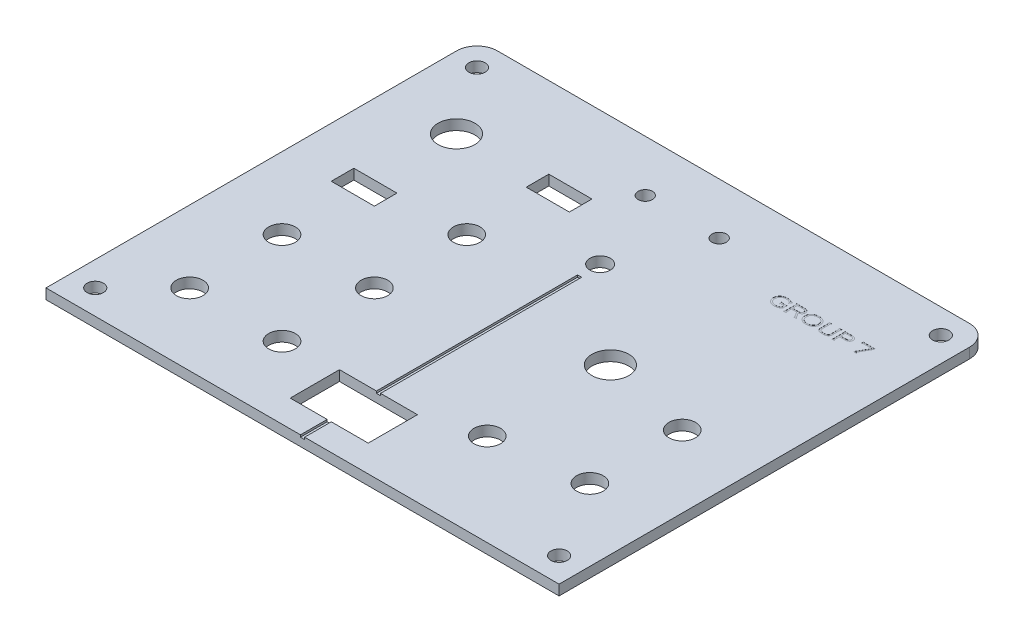
from build123d import *

# Parameters (mm, degrees)
SKETCH1_W               = 125
SKETCH1_H               = 105
BOSS_EXTRUDE1_DEPTH     = 2.5
SKETCH2_R               = 4.5
CUT_EXTRUDE2_DEPTH      = 10
SKETCH3_R               = 3.25
CUT_EXTRUDE3_DEPTH      = 10
SKETCH4_W               = 10.5
SKETCH4_H               = 5.5
CUT_EXTRUDE4_DEPTH      = 20
SKETCH5_R               = 3.25
CUT_EXTRUDE5_DEPTH      = 10
SKETCH6_R               = 4.5
CUT_EXTRUDE6_DEPTH      = 10
SKETCH7_R               = 3.25
CUT_EXTRUDE7_DEPTH      = 10
SKETCH8_W               = 10.5
SKETCH8_H               = 5.5
CUT_EXTRUDE8_DEPTH      = 10
SKETCH9_R               = 3.25
CUT_EXTRUDE9_DEPTH      = 10
SKETCH15_W              = 1
SKETCH15_H              = 70
CUT_EXTRUDE11_DEPTH     = 0.5
SKETCH19_R              = 2
CUT_EXTRUDE13_DEPTH     = 10
MIRROR3_COPY_1_SKETCH_R = 2
MIRROR3_COPY_1_DEPTH    = 10
MIRROR3_COPY_2_SKETCH_R = 2
MIRROR3_COPY_2_DEPTH    = 10
SKETCH20_R              = 2.5
CUT_EXTRUDE14_DEPTH     = 10
SKETCH21_R              = 1.75
CUT_EXTRUDE15_DEPTH     = 10
FILLET1_R               = 5
FILLET2_R               = 5
SKETCH26_W              = 19
SKETCH26_H              = 12
CUT_EXTRUDE16_DEPTH     = 10
SKETCH27_R              = 3.25
CUT_EXTRUDE17_DEPTH     = 10
CUT_EXTRUDE18_DEPTH     = 0.0254


with BuildPart() as part:
    # Sketch1 → Boss-Extrude1 (new body)
    with BuildSketch(Plane(origin=(0, 0, 0), x_dir=(1, 0, 0), z_dir=(0, 1, 0))):
        Rectangle(SKETCH1_W, SKETCH1_H)
    extrude(amount=BOSS_EXTRUDE1_DEPTH)

    # Sketch2 → Cut-Extrude2 (cut)
    with BuildSketch(Plane(origin=(0, 2.5, 0), x_dir=(1, 0, 0), z_dir=(0, 1, 0))):
        with Locations(Location((-45, 30, 0), (0, 0, 270))):
            Circle(SKETCH2_R)
    extrude(amount=-CUT_EXTRUDE2_DEPTH, mode=Mode.SUBTRACT)

    # Sketch3 → Cut-Extrude3 (cut)
    with BuildSketch(Plane(origin=(0, 2.5, 0), x_dir=(1, 0, 0), z_dir=(0, 1, 0))):
        with Locations(Location((-45, -35, 0), (0, 0, 270))):
            Circle(SKETCH3_R)
    extrude(amount=-CUT_EXTRUDE3_DEPTH, mode=Mode.SUBTRACT)

    # Sketch4 → Cut-Extrude4 (cut)
    with BuildSketch(Plane(origin=(0, 2.5, 0), x_dir=(1, 0, 0), z_dir=(0, 1, 0))):
        with Locations((-20, 30)):
            Rectangle(SKETCH4_W, SKETCH4_H)
    extrude(amount=-CUT_EXTRUDE4_DEPTH, mode=Mode.SUBTRACT)

    # Sketch5 → Cut-Extrude5 (cut)
    with BuildSketch(Plane(origin=(0, 2.5, 0), x_dir=(1, 0, 0), z_dir=(0, 1, 0))):
        with Locations(Location((-22.5, 10, 0), (0, 0, 270))):
            Circle(SKETCH5_R)
        with Locations(Location((-22.5, -12.5, 0), (0, 0, 270))):
            Circle(SKETCH5_R)
        with Locations(Location((-22.5, -35, 0), (0, 0, 270))):
            Circle(SKETCH5_R)
    extrude(amount=-CUT_EXTRUDE5_DEPTH, mode=Mode.SUBTRACT)

    # Sketch6 → Cut-Extrude6 (cut)
    with BuildSketch(Plane(origin=(0, 2.5, 0), x_dir=(1, 0, 0), z_dir=(0, 1, 0))):
        with Locations(Location((22.5, 0, 0), (0, 0, 270))):
            Circle(SKETCH6_R)
    extrude(amount=-CUT_EXTRUDE6_DEPTH, mode=Mode.SUBTRACT)

    # Sketch7 → Cut-Extrude7 (cut)
    with BuildSketch(Plane(origin=(0, 2.5, 0), x_dir=(1, 0, 0), z_dir=(0, 1, 0))):
        with Locations(Location((22.5, -30, 0), (0, 0, 270))):
            Circle(SKETCH7_R)
    extrude(amount=-CUT_EXTRUDE7_DEPTH, mode=Mode.SUBTRACT)

    # Sketch8 → Cut-Extrude8 (cut)
    with BuildSketch(Plane(origin=(0, 2.5, 0), x_dir=(1, 0, 0), z_dir=(0, 1, 0))):
        with Locations((-45, 7.5)):
            Rectangle(SKETCH8_W, SKETCH8_H)
    extrude(amount=-CUT_EXTRUDE8_DEPTH, mode=Mode.SUBTRACT)

    # Sketch9 → Cut-Extrude9 (cut)
    with BuildSketch(Plane(origin=(0, 2.5, 0), x_dir=(1, 0, 0), z_dir=(0, 1, 0))):
        with Locations(Location((45, -5, 0), (0, 0, 270))):
            Circle(SKETCH9_R)
        with Locations(Location((45, -27.5, 0), (0, 0, 270))):
            Circle(SKETCH9_R)
    extrude(amount=-CUT_EXTRUDE9_DEPTH, mode=Mode.SUBTRACT)

    # Sketch15 → Cut-Extrude11 (cut)
    with BuildSketch(Plane(origin=(0, 2.5, 0), x_dir=(1, 0, 0), z_dir=(0, 1, 0))):
        with Locations((0, -20)):
            Rectangle(SKETCH15_W, SKETCH15_H)
    extrude(amount=-CUT_EXTRUDE11_DEPTH, mode=Mode.SUBTRACT)

    # Sketch19 → Cut-Extrude13 (cut)
    with BuildSketch(Plane(origin=(0, 2.5, 0), x_dir=(1, 0, 0), z_dir=(0, 1, 0))):
        with Locations(Location((-56.5, 46.5, 0), (0, 0, 270))):
            Circle(SKETCH19_R)
    cut_extrude13 = extrude(amount=-CUT_EXTRUDE13_DEPTH, mode=Mode.SUBTRACT)

    # Mirror1: Cut-Extrude13 across plane
    add(cut_extrude13.mirror(Plane.XY), mode=Mode.SUBTRACT)

    # Mirror2: Cut-Extrude13 across plane
    add(cut_extrude13.mirror(Plane(origin=(0, 0, 0), x_dir=(0, 0, 1), z_dir=(1, 0, 0))), mode=Mode.SUBTRACT)

    # Mirror3 copy 1 sketch → Mirror3 copy 1 (cut)
    with BuildSketch(Plane(origin=(0, 2.5, 0), x_dir=(-1, 0, 0), z_dir=(0, 1, 0))):
        with Locations(Location((-56.5, 46.5, 0), (0, 0, 270))):
            Circle(MIRROR3_COPY_1_SKETCH_R)
    extrude(amount=-MIRROR3_COPY_1_DEPTH, mode=Mode.SUBTRACT)

    # Mirror3 copy 2 sketch → Mirror3 copy 2 (cut)
    with BuildSketch(Plane(origin=(0, 2.5, 0), x_dir=(1, 0, 0), z_dir=(0, 1, 0))):
        with Locations((-56.5, -46.5)):
            Circle(MIRROR3_COPY_2_SKETCH_R)
    extrude(amount=-MIRROR3_COPY_2_DEPTH, mode=Mode.SUBTRACT)

    # Sketch20 → Cut-Extrude14 (cut)
    with BuildSketch(Plane(origin=(0, 2.5, 0), x_dir=(1, 0, 0), z_dir=(0, 1, 0))):
        with Locations(Location((0, 20, 0), (0, 0, 270))):
            Circle(SKETCH20_R)
    extrude(amount=-CUT_EXTRUDE14_DEPTH, mode=Mode.SUBTRACT)

    # Sketch21 → Cut-Extrude15 (cut)
    with BuildSketch(Plane(origin=(0, 2.5, 0), x_dir=(1, 0, 0), z_dir=(0, 1, 0))):
        with Locations(Location((9, 40, 0), (0, 0, 270))):
            Circle(SKETCH21_R)
    cut_extrude15 = extrude(amount=-CUT_EXTRUDE15_DEPTH, mode=Mode.SUBTRACT)

    # Mirror4: Cut-Extrude15 across plane
    add(cut_extrude15.mirror(Plane(origin=(0, 0, 0), x_dir=(0, 0, 1), z_dir=(1, 0, 0))), mode=Mode.SUBTRACT)

    # Fillet1
    fillet1_edges = [part.edges().sort_by_distance(p)[0] for p in [
        (62.5, 1.25, -52.5),
    ]]
    fillet(fillet1_edges, radius=FILLET1_R)

    # Fillet2
    fillet2_edges = [part.edges().sort_by_distance(p)[0] for p in [
        (-62.5, 1.25, -52.5),
    ]]
    fillet(fillet2_edges, radius=FILLET2_R)

    # Sketch26 → Cut-Extrude16 (cut)
    with BuildSketch(Plane(origin=(0, 2.5, 0), x_dir=(1, 0, 0), z_dir=(0, 1, 0))):
        with Locations((0, -40)):
            Rectangle(SKETCH26_W, SKETCH26_H)
    extrude(amount=-CUT_EXTRUDE16_DEPTH, mode=Mode.SUBTRACT)

    # Sketch27 → Cut-Extrude17 (cut)
    with BuildSketch(Plane(origin=(0, 2.5, 0), x_dir=(1, 0, 0), z_dir=(0, 1, 0))):
        with Locations(Location((-45, -12.5, 0), (0, 0, 270))):
            Circle(SKETCH27_R)
    extrude(amount=-CUT_EXTRUDE17_DEPTH, mode=Mode.SUBTRACT)

    # Sketch28 → Cut-Extrude18 (cut)
    # profile 1 of 6: a face of its own
    with BuildSketch(Plane(origin=(0, 2.5, 0), x_dir=(1, 0, 0), z_dir=(0, 1, 0))):
        with BuildLine():
            Line((31.594782388, 35.297109122), (31.219955999, 34.730046405))
            Line((31.219955999, 34.730046405), (31.160011338, 34.77207657))
            add(Edge.make_bspline(
                [(31.160011338, 34.77207657), (31.166130945, 34.782793931), (31.177399026, 34.802527892), (31.190781805, 34.830659801), (31.198988564, 34.854782467), (31.200635517, 34.86964734), (31.201352483, 34.876118454)],
                knots=[0, 0, 0, 0, 1.311070168, 2.41408384, 3.309604391, 4, 4, 4, 4], degree=3))
            add(Edge.make_bspline(
                [(31.201352483, 34.876118454), (31.200333577, 34.882663261), (31.198104889, 34.896978925), (31.185619937, 34.918420066), (31.165726489, 34.940798246), (31.13868146, 34.965813022), (31.103130154, 34.991275361), (31.060883564, 35.01996203), (31.010528596, 35.04993), (30.974037205, 35.070073714), (30.954683647, 35.080757126)],
                knots=[0, 0, 0, 0, 0.479681411, 1.049222262, 1.774183608, 2.663260629, 3.728642312, 4.959827133, 6.387615278, 8, 8, 8, 8], degree=3))
            add(Edge.make_bspline(
                [(30.954683647, 35.080757126), (30.915222774, 35.101754293), (30.837249692, 35.143243843), (30.716668915, 35.195201455), (30.596153125, 35.240002881), (30.474990034, 35.278043441), (30.352552577, 35.30589116), (30.229412563, 35.325771899), (30.105864155, 35.338866024), (30.023162275, 35.340425953), (29.981788681, 35.341206344)],
                knots=[0, 0, 0, 0, 1.053577382, 2.081826103, 3.092788234, 4.084582288, 5.073770794, 6.050427979, 7.024679971, 8, 8, 8, 8], degree=3))
            add(Edge.make_bspline(
                [(29.981788681, 35.341206344), (29.934423314, 35.34045827), (29.841480579, 35.338990362), (29.704956856, 35.322137651), (29.57391722, 35.297303577), (29.448480239, 35.261238292), (29.329077662, 35.215009369), (29.215038342, 35.158770186), (29.10664523, 35.092279306), (29.039667471, 35.040062569), (29.00613764, 35.013922273)],
                knots=[0, 0, 0, 0, 1.081755317, 2.122675345, 3.138566733, 4.12691774, 5.100570372, 6.060533882, 7.029081099, 8, 8, 8, 8], degree=3))
            add(Edge.make_bspline(
                [(29.00613764, 35.013922273), (28.970011743, 34.982315643), (28.898826824, 34.920035793), (28.806170418, 34.814073181), (28.726661254, 34.700868294), (28.663138266, 34.578247795), (28.613247821, 34.447871609), (28.577573642, 34.309461509), (28.555631276, 34.162997444), (28.553277695, 34.062694978), (28.552074055, 34.011399487)],
                knots=[0, 0, 0, 0, 1.009781546, 1.98974211, 2.955664053, 3.916098172, 4.889689536, 5.889075866, 6.920456337, 8, 8, 8, 8], degree=3))
            add(Edge.make_bspline(
                [(28.552074055, 34.011399487), (28.553299611, 33.961248141), (28.555694247, 33.863256475), (28.577271647, 33.720451197), (28.610189814, 33.585135564), (28.659301214, 33.458333723), (28.720593036, 33.338528295), (28.797161691, 33.227557918), (28.886346933, 33.123444068), (28.955297558, 33.062528937), (28.9902902, 33.031614331)],
                knots=[0, 0, 0, 0, 1.082875897, 2.115851736, 3.113542928, 4.085773228, 5.04674435, 6.01430349, 6.99225325, 8, 8, 8, 8], degree=3))
            add(Edge.make_bspline(
                [(28.9902902, 33.031614331), (29.02446509, 33.00472398), (29.092779049, 32.950971462), (29.204798803, 32.882789617), (29.323644404, 32.824825608), (29.449304011, 32.777167793), (29.58198624, 32.740605794), (29.721666732, 32.714671039), (29.868413219, 32.698553967), (29.968655533, 32.696446059), (30.019684732, 32.695373011)],
                knots=[0, 0, 0, 0, 0.943408857, 1.885828905, 2.840281506, 3.810814444, 4.799180104, 5.824075897, 6.892327404, 8, 8, 8, 8], degree=3))
            add(Edge.make_bspline(
                [(30.019684732, 32.695373011), (30.074172649, 32.69650655), (30.182347313, 32.698756961), (30.342354488, 32.718532528), (30.498271698, 32.751183301), (30.649093012, 32.795561764), (30.792486327, 32.851434263), (30.925044757, 32.918441143), (31.046661489, 32.994532651), (31.118391993, 33.054874147), (31.153810166, 33.084668801)],
                knots=[0, 0, 0, 0, 1.067475704, 2.119255615, 3.153810372, 4.186316862, 5.196810412, 6.165000349, 7.093937309, 8, 8, 8, 8], degree=3))
            Line((31.153810166, 33.084668801), (31.153810166, 33.6655119))
            Line((31.153810166, 33.6655119), (30.422760904, 33.6655119))
            add(Edge.make_bspline(
                [(30.422760904, 33.6655119), (30.408033476, 33.665447177), (30.380750286, 33.665327275), (30.343381466, 33.659536224), (30.312486127, 33.651884758), (30.287409096, 33.639907792), (30.267420751, 33.622011454), (30.251947781, 33.597695766), (30.238097114, 33.567777713), (30.23137128, 33.545274419), (30.227768499, 33.533220233)],
                knots=[0, 0, 0, 0, 1.342563101, 2.487155639, 3.44341224, 4.240445972, 4.99788562, 5.858567641, 6.852913584, 8, 8, 8, 8], degree=3))
            Line((30.227768499, 33.533220233), (30.139574055, 33.533220233))
            Line((30.139574055, 33.533220233), (30.139574055, 34.106484122))
            Line((30.139574055, 34.106484122), (30.227768499, 34.106484122))
            add(Edge.make_bspline(
                [(30.227768499, 34.106484122), (30.23137128, 34.094429937), (30.238097114, 34.071926642), (30.251947781, 34.042008589), (30.267420751, 34.017692902), (30.287409096, 33.999796563), (30.312486127, 33.987819597), (30.343381466, 33.980168131), (30.380750286, 33.974377081), (30.408033476, 33.974257179), (30.422760904, 33.974192456)],
                knots=[0, 0, 0, 0, 1.147086416, 2.141432359, 3.00211438, 3.759554028, 4.55658776, 5.512844361, 6.657436899, 8, 8, 8, 8], degree=3))
            Line((30.422760904, 33.974192456), (31.63887961, 33.974192456))
            Line((31.63887961, 33.974192456), (31.63887961, 33.885998011))
            add(Edge.make_bspline(
                [(31.63887961, 33.885998011), (31.626869265, 33.882307271), (31.604538478, 33.875445094), (31.574176409, 33.862703005), (31.550593635, 33.84697059), (31.532399971, 33.828715376), (31.520142997, 33.805519601), (31.512543175, 33.776611416), (31.50675803, 33.741298274), (31.50664771, 33.715381547), (31.506587944, 33.701340893)],
                knots=[0, 0, 0, 0, 1.188810764, 2.21035107, 3.102339709, 3.855401953, 4.62367284, 5.551978086, 6.67375882, 8, 8, 8, 8], degree=3))
            Line((31.506587944, 33.701340893), (31.506587944, 33.321002351))
            add(Edge.make_bspline(
                [(31.506587944, 33.321002351), (31.50661705, 33.306955162), (31.506670304, 33.281253696), (31.51275539, 33.246017588), (31.519982618, 33.216993077), (31.53244028, 33.193678001), (31.550383931, 33.175276387), (31.574587996, 33.16060445), (31.60430058, 33.146631973), (31.626817907, 33.139933408), (31.63887961, 33.136345233)],
                knots=[0, 0, 0, 0, 1.326839066, 2.427653517, 3.377261368, 4.145878602, 4.899280336, 5.779674258, 6.810653305, 8, 8, 8, 8], degree=3))
            Line((31.63887961, 33.136345233), (31.63887961, 33.048150789))
            add(Edge.make_bspline(
                [(31.63887961, 33.048150789), (31.596074441, 33.010042594), (31.513208855, 32.93626978), (31.387083282, 32.836593533), (31.265188124, 32.749292625), (31.182623783, 32.69990863), (31.14278586, 32.676080476)],
                knots=[0, 0, 0, 0, 1.106719285, 2.142473504, 3.103729327, 4, 4, 4, 4], degree=3))
            add(Edge.make_bspline(
                [(31.14278586, 32.676080476), (31.100119022, 32.653014832), (31.0147509, 32.60686492), (30.881530813, 32.54764766), (30.743773126, 32.497928287), (30.601499491, 32.457219058), (30.454617206, 32.425675965), (30.303467833, 32.402789486), (30.147842972, 32.389751323), (30.042675591, 32.387721394), (29.989367891, 32.386692456)],
                knots=[0, 0, 0, 0, 0.967559955, 1.935901058, 2.905759258, 3.887798191, 4.886463983, 5.901453271, 6.93627949, 8, 8, 8, 8], degree=3))
            add(Edge.make_bspline(
                [(29.989367891, 32.386692456), (29.924546131, 32.388008607), (29.797571628, 32.390586718), (29.612127204, 32.4109367), (29.435909264, 32.443586933), (29.269485904, 32.490616526), (29.112042122, 32.550308256), (28.9647697, 32.624883434), (28.825807935, 32.710902539), (28.741999399, 32.779621563), (28.700213161, 32.813884296)],
                knots=[0, 0, 0, 0, 1.120561648, 2.19498449, 3.221503495, 4.215912035, 5.181296155, 6.127874861, 7.066573986, 8, 8, 8, 8], degree=3))
            add(Edge.make_bspline(
                [(28.700213161, 32.813884296), (28.66131726, 32.849874912), (28.583646383, 32.921744253), (28.480834421, 33.043281848), (28.390586769, 33.175355623), (28.340797656, 33.269950767), (28.315740504, 33.317557256)],
                knots=[0, 0, 0, 0, 0.996438765, 1.989779697, 2.98832511, 4, 4, 4, 4], degree=3))
            add(Edge.make_bspline(
                [(28.315740504, 33.317557256), (28.302733198, 33.345416613), (28.276836782, 33.400882169), (28.24476816, 33.486728232), (28.217235887, 33.57343859), (28.194143743, 33.661189546), (28.177118579, 33.750326377), (28.164771052, 33.840483446), (28.156905371, 33.931794579), (28.155770102, 33.993010083), (28.155199055, 34.023801831)],
                knots=[0, 0, 0, 0, 1.010000702, 2.010823509, 3.008539713, 3.998863838, 4.990567406, 5.988540485, 6.988224375, 8, 8, 8, 8], degree=3))
            add(Edge.make_bspline(
                [(28.155199055, 34.023801831), (28.156122175, 34.067707172), (28.157949354, 34.154611278), (28.172613734, 34.283023536), (28.197428059, 34.407448084), (28.232283001, 34.527789506), (28.275518837, 34.644913648), (28.329468496, 34.758125269), (28.393758221, 34.867369972), (28.443137455, 34.936418049), (28.468013725, 34.971203089)],
                knots=[0, 0, 0, 0, 1.037084025, 2.052753884, 3.048797332, 4.031149219, 5.009807646, 5.995211902, 6.990027867, 8, 8, 8, 8], degree=3))
            add(Edge.make_bspline(
                [(28.468013725, 34.971203089), (28.492816029, 35.002372965), (28.542106725, 35.06431821), (28.624217742, 35.15020635), (28.712330014, 35.229280002), (28.806657833, 35.302201887), (28.907457895, 35.368305212), (29.014455052, 35.427986546), (29.12704751, 35.482671507), (29.205921641, 35.512245459), (29.245916286, 35.527241501)],
                knots=[0, 0, 0, 0, 0.985391011, 1.958310304, 2.936346382, 3.912927983, 4.906091213, 5.916379487, 6.943460142, 8, 8, 8, 8], degree=3))
            add(Edge.make_bspline(
                [(29.245916286, 35.527241501), (29.304177778, 35.5462643), (29.421616134, 35.584608773), (29.604756854, 35.622149207), (29.793980812, 35.645723267), (29.922230803, 35.648485453), (29.987300834, 35.6498869)],
                knots=[0, 0, 0, 0, 0.973473779, 1.962242214, 2.966105487, 4, 4, 4, 4], degree=3))
            add(Edge.make_bspline(
                [(29.987300834, 35.6498869), (30.044071348, 35.649111777), (30.156005284, 35.647583474), (30.320297404, 35.631016762), (30.478524264, 35.605877346), (30.63234448, 35.569434928), (30.786161663, 35.521106941), (30.943238583, 35.45908394), (31.106197515, 35.384755522), (31.214519563, 35.326885119), (31.270254393, 35.297109122)],
                knots=[0, 0, 0, 0, 1.011571596, 1.994507037, 2.940101153, 3.865550783, 4.809441924, 5.811416899, 6.873910635, 8, 8, 8, 8], degree=3))
            add(Edge.make_bspline(
                [(31.270254393, 35.297109122), (31.285413635, 35.289057726), (31.312188959, 35.274836782), (31.34724412, 35.256370266), (31.373012563, 35.245048134), (31.387576223, 35.242302287), (31.392899792, 35.241298575)],
                knots=[0, 0, 0, 0, 1.521960149, 2.68819359, 3.52048505, 4, 4, 4, 4], degree=3))
            add(Edge.make_bspline(
                [(31.392899792, 35.241298575), (31.40022175, 35.242917324), (31.417801171, 35.246803808), (31.443323344, 35.26789477), (31.474051279, 35.297967275), (31.494905849, 35.323473461), (31.506587944, 35.337761249)],
                knots=[0, 0, 0, 0, 0.585328424, 1.405325703, 2.546542555, 4, 4, 4, 4], degree=3))
            Line((31.506587944, 35.337761249), (31.594782388, 35.297109122))
        make_face()
    # profile 2 of 6: a face of its own
    with BuildSketch(Plane(origin=(0, 2.5, 0), x_dir=(1, 0, 0), z_dir=(0, 1, 0))):
        with BuildLine():
            Line((32.741310166, 33.841900789), (32.741310166, 32.713976527))
            add(Edge.make_bspline(
                [(32.741310166, 32.713976527), (32.741377796, 32.699480081), (32.741502936, 32.672656274), (32.747239626, 32.635949306), (32.755078201, 32.605587775), (32.766881916, 32.580657371), (32.784991141, 32.56072607), (32.809028136, 32.54449136), (32.839000258, 32.529981083), (32.861544025, 32.522816296), (32.873601832, 32.518984122)],
                knots=[0, 0, 0, 0, 1.327292751, 2.455984248, 3.396056187, 4.196519374, 4.957218112, 5.833575765, 6.841261664, 8, 8, 8, 8], degree=3))
            Line((32.873601832, 32.518984122), (32.873601832, 32.430789678))
            Line((32.873601832, 32.430789678), (32.256240721, 32.430789678))
            Line((32.256240721, 32.430789678), (32.256240721, 32.518984122))
            add(Edge.make_bspline(
                [(32.256240721, 32.518984122), (32.268298611, 32.52281627), (32.290842532, 32.52998101), (32.320813657, 32.544491593), (32.344853728, 32.56072536), (32.362953059, 32.580659697), (32.374892792, 32.605780085), (32.382637052, 32.6368783), (32.388325947, 32.674730546), (32.388460071, 32.702466716), (32.388532388, 32.717421622)],
                knots=[0, 0, 0, 0, 1.143860438, 2.138607913, 3.003713363, 3.754644928, 4.544830376, 5.492870617, 6.648195317, 8, 8, 8, 8], degree=3))
            Line((32.388532388, 32.717421622), (32.388532388, 35.319157733))
            add(Edge.make_bspline(
                [(32.388532388, 35.319157733), (32.388471777, 35.334116777), (32.388359365, 35.361860619), (32.382500072, 35.3998842), (32.375074358, 35.431334011), (32.36273294, 35.456652082), (32.345116394, 35.477216875), (32.320925725, 35.493517268), (32.290770012, 35.507218021), (32.268285074, 35.513975501), (32.256240721, 35.517595233)],
                knots=[0, 0, 0, 0, 1.348407392, 2.500828586, 3.466505965, 4.254705557, 5.01937148, 5.882302788, 6.865627628, 8, 8, 8, 8], degree=3))
            Line((32.256240721, 35.517595233), (32.256240721, 35.605789678))
            Line((32.256240721, 35.605789678), (34.001526095, 35.605789678))
            add(Edge.make_bspline(
                [(34.001526095, 35.605789678), (34.058030257, 35.605170756), (34.165112088, 35.603997829), (34.316412242, 35.59777411), (34.44910033, 35.585520404), (34.565237004, 35.568652482), (34.668510161, 35.544979191), (34.763080396, 35.514500872), (34.850918661, 35.477250601), (34.904673201, 35.445599035), (34.931012857, 35.430089808)],
                knots=[0, 0, 0, 0, 1.414819568, 2.681244393, 3.790189265, 4.749857557, 5.617503166, 6.439488343, 7.235351294, 8, 8, 8, 8], degree=3))
            add(Edge.make_bspline(
                [(34.931012857, 35.430089808), (34.956827446, 35.412643095), (35.008263782, 35.37788), (35.076055314, 35.312820689), (35.137525131, 35.240065424), (35.170591476, 35.185072725), (35.187327961, 35.157238245)],
                knots=[0, 0, 0, 0, 0.987068848, 1.966764049, 2.970880412, 4, 4, 4, 4], degree=3))
            add(Edge.make_bspline(
                [(35.187327961, 35.157238245), (35.204589578, 35.123660038), (35.239110248, 35.056508607), (35.274026657, 34.947341433), (35.295175681, 34.832164867), (35.297675285, 34.753107603), (35.298949055, 34.712820928)],
                knots=[0, 0, 0, 0, 0.976717653, 1.953290301, 2.95702022, 4, 4, 4, 4], degree=3))
            add(Edge.make_bspline(
                [(35.298949055, 34.712820928), (35.298452673, 34.682686372), (35.297478633, 34.623553881), (35.284938509, 34.537179), (35.266980315, 34.45454069), (35.239760292, 34.37666138), (35.205659744, 34.302805467), (35.164557797, 34.232772577), (35.114197801, 34.168104961), (35.057928512, 34.107168779), (34.994400281, 34.052272585), (34.925196995, 34.003102415), (34.850386707, 33.960297256), (34.769924871, 33.923551147), (34.683590086, 33.893475879), (34.591730902, 33.869208215), (34.494158376, 33.85221557), (34.427160948, 33.845391558), (34.392888942, 33.841900789)],
                knots=[0, 0, 0, 0, 1.032453981, 2.025965659, 2.986981725, 3.928436394, 4.848129052, 5.773335344, 6.705853521, 7.653153547, 8.613330213, 9.579206836, 10.559963337, 11.56437173, 12.608029044, 13.691145095, 14.818923504, 16, 16, 16, 16], degree=3))
            Line((34.392888942, 33.841900789), (35.182504827, 32.632672273))
            add(Edge.make_bspline(
                [(35.182504827, 32.632672273), (35.194774465, 32.615392962), (35.218481664, 32.582006152), (35.267305614, 32.544818572), (35.324671622, 32.522273835), (35.36580097, 32.520108), (35.387143499, 32.518984122)],
                knots=[0, 0, 0, 0, 1.032470711, 1.994923467, 2.959540884, 4, 4, 4, 4], degree=3))
            Line((35.387143499, 32.518984122), (35.387143499, 32.430789678))
            Line((35.387143499, 32.430789678), (34.706392631, 32.430789678))
            Line((34.706392631, 32.430789678), (34.706392631, 32.518984122))
            add(Edge.make_bspline(
                [(34.706392631, 32.518984122), (34.72214855, 32.522248526), (34.749841337, 32.527986079), (34.784632323, 32.540553213), (34.808642906, 32.558856801), (34.812259175, 32.575096802), (34.81387961, 32.582373879)],
                knots=[0, 0, 0, 0, 1.445170674, 2.540048811, 3.345801974, 4, 4, 4, 4], degree=3))
            add(Edge.make_bspline(
                [(34.81387961, 32.582373879), (34.812441002, 32.588404364), (34.808420073, 32.605259642), (34.792841174, 32.635451072), (34.769774131, 32.678757992), (34.750006163, 32.711324077), (34.738776529, 32.729823966)],
                knots=[0, 0, 0, 0, 0.44689934, 1.249089129, 2.437283923, 4, 4, 4, 4], degree=3))
            Line((34.738776529, 32.729823966), (34.024263725, 33.841900789))
            Line((34.024263725, 33.841900789), (32.741310166, 33.841900789))
        make_face()
        with BuildLine():
            Line((32.741310166, 34.150581344), (34.029086858, 34.150581344))
            add(Edge.make_bspline(
                [(34.029086858, 34.150581344), (34.070202146, 34.150809841), (34.147174006, 34.151237609), (34.254494553, 34.155220334), (34.345781959, 34.161778272), (34.422921434, 34.171250438), (34.490242583, 34.184635226), (34.551610724, 34.202475452), (34.609105239, 34.225053611), (34.644768834, 34.243955845), (34.662295409, 34.25324519)],
                knots=[0, 0, 0, 0, 1.520823022, 2.847130214, 3.971774452, 4.905411492, 5.72015636, 6.507876598, 7.266708457, 8, 8, 8, 8], degree=3))
            add(Edge.make_bspline(
                [(34.662295409, 34.25324519), (34.681580958, 34.265271566), (34.719392294, 34.288850534), (34.767767668, 34.334210729), (34.809932507, 34.38397643), (34.843672542, 34.440425252), (34.870248609, 34.502512064), (34.888353094, 34.570761238), (34.900651368, 34.644624234), (34.901590348, 34.69600094), (34.902074055, 34.722467195)],
                knots=[0, 0, 0, 0, 0.982641165, 1.926570845, 2.859311877, 3.801456098, 4.764550391, 5.776195376, 6.854426767, 8, 8, 8, 8], degree=3))
            add(Edge.make_bspline(
                [(34.902074055, 34.722467195), (34.901186583, 34.749139408), (34.899464943, 34.800881892), (34.888920871, 34.875533977), (34.869259371, 34.943972754), (34.842449021, 35.006820255), (34.807198476, 35.063392049), (34.764293182, 35.113988085), (34.713810049, 35.158614041), (34.675090583, 35.182368348), (34.655405218, 35.194445277)],
                knots=[0, 0, 0, 0, 1.141908399, 2.215233359, 3.217213402, 4.181493512, 5.130824203, 6.058529557, 7.012936919, 8, 8, 8, 8], degree=3))
            add(Edge.make_bspline(
                [(34.655405218, 35.194445277), (34.636700589, 35.20389616), (34.599036897, 35.222926484), (34.539658647, 35.246872387), (34.476513619, 35.263390949), (34.408473876, 35.277174859), (34.329505675, 35.286938619), (34.234701727, 35.292153489), (34.121455885, 35.296578938), (34.039887554, 35.296923689), (33.996013942, 35.297109122)],
                knots=[0, 0, 0, 0, 0.745341083, 1.500820907, 2.271778287, 3.063238885, 3.96911947, 5.09888871, 6.439563143, 8, 8, 8, 8], degree=3))
            Line((33.996013942, 35.297109122), (32.741310166, 35.297109122))
            Line((32.741310166, 35.297109122), (32.741310166, 34.150581344))
        make_face(mode=Mode.SUBTRACT)
    # profile 3 of 6: a face of its own
    with BuildSketch(Plane(origin=(0, 2.5, 0), x_dir=(1, 0, 0), z_dir=(0, 1, 0))):
        with BuildLine():
            add(Edge.make_bspline(
                [(37.718784124, 35.6498869), (37.787055082, 35.648648658), (37.92047783, 35.646228748), (38.115288798, 35.624880597), (38.300002229, 35.591752167), (38.474559546, 35.544037299), (38.639203032, 35.482858711), (38.793554847, 35.407379701), (38.938129598, 35.318566014), (39.026055029, 35.248644935), (39.069950574, 35.213737811)],
                knots=[0, 0, 0, 0, 1.129612801, 2.20761577, 3.239501009, 4.232676901, 5.19856252, 6.14208603, 7.072462372, 8, 8, 8, 8], degree=3))
            add(Edge.make_bspline(
                [(39.069950574, 35.213737811), (39.093431482, 35.193374102), (39.140354775, 35.152680092), (39.205321208, 35.086446873), (39.266289047, 35.017229453), (39.323157282, 34.944868364), (39.374524711, 34.868392186), (39.421547245, 34.788725834), (39.46455997, 34.705999314), (39.489439088, 34.648668839), (39.501965548, 34.61980335)],
                knots=[0, 0, 0, 0, 1.005456374, 2.009263195, 2.99930056, 3.989477404, 4.985134177, 5.978096491, 6.981985854, 8, 8, 8, 8], degree=3))
            add(Edge.make_bspline(
                [(39.501965548, 34.61980335), (39.520238369, 34.571214914), (39.556998822, 34.473466847), (39.593280943, 34.319885854), (39.616135806, 34.161150576), (39.61901746, 34.053510126), (39.620476832, 33.998997143)],
                knots=[0, 0, 0, 0, 0.978870405, 1.969248235, 2.971554498, 4, 4, 4, 4], degree=3))
            add(Edge.make_bspline(
                [(39.620476832, 33.998997143), (39.619599045, 33.961766893), (39.617850024, 33.887584392), (39.606328829, 33.777106479), (39.5849266, 33.668914729), (39.557917966, 33.561946232), (39.520871175, 33.457423982), (39.476819493, 33.35436203), (39.424328665, 33.253208803), (39.383468798, 33.188431143), (39.36278369, 33.155637768)],
                knots=[0, 0, 0, 0, 0.998791673, 1.990125373, 2.97492797, 3.955229716, 4.947022809, 5.946137479, 6.960242109, 8, 8, 8, 8], degree=3))
            add(Edge.make_bspline(
                [(39.36278369, 33.155637768), (39.338564268, 33.120289091), (39.290463193, 33.050084715), (39.208431797, 32.953160193), (39.120803294, 32.862712876), (39.02531482, 32.78075313), (38.923047334, 32.706050205), (38.813742813, 32.639210218), (38.697790048, 32.579393984), (38.616400789, 32.546596891), (38.575234862, 32.530008428)],
                knots=[0, 0, 0, 0, 1.004651634, 1.995292206, 2.974496599, 3.956306444, 4.943468318, 5.942396716, 6.959283489, 8, 8, 8, 8], degree=3))
            add(Edge.make_bspline(
                [(38.575234862, 32.530008428), (38.543434399, 32.518380606), (38.479476076, 32.494994281), (38.380373599, 32.466458872), (38.278622481, 32.441419098), (38.173445149, 32.421710543), (38.065230589, 32.405575581), (37.953670834, 32.395021805), (37.839232373, 32.38764321), (37.76197488, 32.387011705), (37.722918239, 32.386692456)],
                knots=[0, 0, 0, 0, 0.934826263, 1.880158805, 2.84626528, 3.827761024, 4.834209658, 5.866742649, 6.921556159, 8, 8, 8, 8], degree=3))
            add(Edge.make_bspline(
                [(37.722918239, 32.386692456), (37.655107025, 32.387938445), (37.522372975, 32.390377351), (37.328473984, 32.411689531), (37.144458816, 32.444851705), (36.970751056, 32.492393186), (36.807143653, 32.553892591), (36.653636594, 32.629185753), (36.509758616, 32.718030019), (36.422306124, 32.787937464), (36.37864198, 32.822841544)],
                knots=[0, 0, 0, 0, 1.127024368, 2.206043841, 3.238781121, 4.232709334, 5.195758597, 6.140066014, 7.071353774, 8, 8, 8, 8], degree=3))
            add(Edge.make_bspline(
                [(36.37864198, 32.822841544), (36.35515256, 32.843430631), (36.30844858, 32.884367884), (36.243786184, 32.951112118), (36.18287945, 33.020482644), (36.127254256, 33.093823869), (36.075452825, 33.169681186), (36.027569196, 33.248652905), (35.984116143, 33.330955596), (35.959139526, 33.388132254), (35.946627006, 33.416776006)],
                knots=[0, 0, 0, 0, 1.011096338, 2.010361431, 3.006660641, 3.998842894, 4.989016114, 5.98008274, 6.988083389, 8, 8, 8, 8], degree=3))
            add(Edge.make_bspline(
                [(35.946627006, 33.416776006), (35.928392899, 33.464680919), (35.89195276, 33.560416988), (35.855339321, 33.710217515), (35.832559642, 33.863702427), (35.829603513, 33.96745168), (35.828115721, 34.019667716)],
                knots=[0, 0, 0, 0, 0.994164706, 1.98679875, 2.986774507, 4, 4, 4, 4], degree=3))
            add(Edge.make_bspline(
                [(35.828115721, 34.019667716), (35.828958683, 34.058281377), (35.830633405, 34.134995635), (35.842591397, 34.249006899), (35.862381334, 34.360760923), (35.89105189, 34.469997753), (35.926721605, 34.577241944), (35.971125515, 34.681828821), (36.022628054, 34.784607971), (36.063242094, 34.850001581), (36.083741806, 34.883008645)],
                knots=[0, 0, 0, 0, 1.014818375, 2.016152715, 3.009649952, 3.995044388, 4.981990861, 5.977595005, 6.97920226, 8, 8, 8, 8], degree=3))
            add(Edge.make_bspline(
                [(36.083741806, 34.883008645), (36.10747437, 34.917916624), (36.154682745, 34.987354929), (36.236264304, 35.083207864), (36.324341649, 35.172299729), (36.420003863, 35.253785326), (36.522385163, 35.328594947), (36.632214864, 35.396176286), (36.749436701, 35.456471703), (36.831736977, 35.489744355), (36.873357692, 35.506570928)],
                knots=[0, 0, 0, 0, 0.989484021, 1.968263269, 2.947264875, 3.925421255, 4.912438463, 5.918631609, 6.947414939, 8, 8, 8, 8], degree=3))
            add(Edge.make_bspline(
                [(36.873357692, 35.506570928), (36.903774317, 35.517758809), (36.9651725, 35.540342366), (37.061154267, 35.567431301), (37.160617489, 35.59162751), (37.264544333, 35.611636943), (37.372384034, 35.627382136), (37.484360309, 35.638752944), (37.600138808, 35.647635861), (37.678803599, 35.649128356), (37.718784124, 35.6498869)],
                knots=[0, 0, 0, 0, 0.902246132, 1.821249792, 2.77533096, 3.75252328, 4.767441222, 5.809311129, 6.886606205, 8, 8, 8, 8], degree=3))
        make_face()
        with BuildLine():
            add(Edge.make_bspline(
                [(37.718784124, 35.341206344), (37.661547444, 35.340053624), (37.549744103, 35.337801957), (37.386443637, 35.319134287), (37.232547929, 35.287322651), (37.087291854, 35.244341125), (36.951836847, 35.187267623), (36.824810979, 35.11916464), (36.707210892, 35.037591294), (36.637040642, 34.973623971), (36.601884167, 34.941575268)],
                knots=[0, 0, 0, 0, 1.128525398, 2.204406482, 3.235699143, 4.224388685, 5.186685981, 6.129057779, 7.062626515, 8, 8, 8, 8], degree=3))
            add(Edge.make_bspline(
                [(36.601884167, 34.941575268), (36.57179477, 34.910720881), (36.512271939, 34.849684749), (36.435738611, 34.748141348), (36.370633402, 34.641029738), (36.317298652, 34.528091869), (36.275717161, 34.409413682), (36.245990711, 34.284781764), (36.228790028, 34.154048106), (36.226271355, 34.064963369), (36.224990721, 34.019667716)],
                knots=[0, 0, 0, 0, 1.008980271, 1.995964253, 2.971497028, 3.941626714, 4.916862578, 5.912784804, 6.938743291, 8, 8, 8, 8], degree=3))
            add(Edge.make_bspline(
                [(36.224990721, 34.019667716), (36.226259013, 33.974141274), (36.228747233, 33.88482446), (36.246061676, 33.753649569), (36.275732864, 33.628563207), (36.317145879, 33.509349625), (36.370655535, 33.396250487), (36.435709817, 33.289102639), (36.512468382, 33.187536641), (36.571822334, 33.126113787), (36.601884167, 33.095004087)],
                knots=[0, 0, 0, 0, 1.064021848, 2.087469132, 3.086175838, 4.064091798, 5.031846932, 6.004991929, 6.989560106, 8, 8, 8, 8], degree=3))
            add(Edge.make_bspline(
                [(36.601884167, 33.095004087), (36.636787287, 33.062927806), (36.706578746, 32.998788826), (36.824152317, 32.917458349), (36.951299093, 32.849136557), (37.087318271, 32.792262023), (37.233241498, 32.749256184), (37.388049645, 32.717382926), (37.55250575, 32.698789954), (37.665223196, 32.696529855), (37.722918239, 32.695373011)],
                knots=[0, 0, 0, 0, 0.930753399, 1.861112707, 2.800244815, 3.763399471, 4.75301258, 5.785180892, 6.866332692, 8, 8, 8, 8], degree=3))
            add(Edge.make_bspline(
                [(37.722918239, 32.695373011), (37.780842457, 32.696530816), (37.894016961, 32.698792977), (38.059162971, 32.717376672), (38.214642505, 32.749286276), (38.361098888, 32.792101974), (38.49743236, 32.849314732), (38.625119499, 32.917428526), (38.743369974, 32.99877751), (38.813639193, 33.062927563), (38.848775444, 33.095004087)],
                knots=[0, 0, 0, 0, 1.134093072, 2.21583345, 3.248703155, 4.239073098, 5.198770883, 6.138490523, 7.069201797, 8, 8, 8, 8], degree=3))
            add(Edge.make_bspline(
                [(38.848775444, 33.095004087), (38.878898691, 33.12583541), (38.938263364, 33.186595506), (39.01392432, 33.287858971), (39.079351075, 33.393090006), (39.131899478, 33.504687297), (39.173663474, 33.621098482), (39.201967798, 33.743235379), (39.221025026, 33.870239171), (39.222731837, 33.956894342), (39.223601832, 34.0010642)],
                knots=[0, 0, 0, 0, 1.024908978, 2.019814964, 3.001416639, 3.969700935, 4.950023213, 5.939130583, 6.949534016, 8, 8, 8, 8], degree=3))
            add(Edge.make_bspline(
                [(39.223601832, 34.0010642), (39.222719936, 34.048443653), (39.220987999, 34.141491069), (39.202178059, 34.277224968), (39.174126804, 34.406352002), (39.1317924, 34.52762244), (39.080074467, 34.642868191), (39.014203537, 34.749809881), (38.938627932, 34.851250858), (38.878944236, 34.911248023), (38.848775444, 34.941575268)],
                knots=[0, 0, 0, 0, 1.090457954, 2.141525268, 3.15014253, 4.128699665, 5.094406147, 6.053265364, 7.015968536, 8, 8, 8, 8], degree=3))
            add(Edge.make_bspline(
                [(38.848775444, 34.941575268), (38.811300433, 34.975219299), (38.737856085, 35.041155609), (38.618701762, 35.124636427), (38.495555102, 35.193032173), (38.409177825, 35.225327647), (38.366462075, 35.241298575)],
                knots=[0, 0, 0, 0, 1.055352731, 2.068303461, 3.04472719, 4, 4, 4, 4], degree=3))
            add(Edge.make_bspline(
                [(38.366462075, 35.241298575), (38.317547651, 35.25645015), (38.217826991, 35.287339301), (38.059884546, 35.317370858), (37.892695188, 35.337249915), (37.777641832, 35.339867347), (37.718784124, 35.341206344)],
                knots=[0, 0, 0, 0, 0.933174879, 1.902441171, 2.926954332, 4, 4, 4, 4], degree=3))
        make_face(mode=Mode.SUBTRACT)
    # profile 4 of 6: a face of its own
    with BuildSketch(Plane(origin=(0, 2.5, 0), x_dir=(1, 0, 0), z_dir=(0, 1, 0))):
        with BuildLine():
            Line((40.678810166, 35.318468714), (40.678810166, 33.571805303))
            add(Edge.make_bspline(
                [(40.678810166, 33.571805303), (40.678969312, 33.546999032), (40.679275838, 33.499220384), (40.680844987, 33.430555029), (40.682206394, 33.367548784), (40.687111044, 33.310439883), (40.690572861, 33.258654093), (40.696302791, 33.212737862), (40.702194263, 33.172418327), (40.712054915, 33.12683609), (40.729857294, 33.07513209), (40.758757136, 33.017683162), (40.79656391, 32.964146018), (40.82760706, 32.933111444), (40.84348573, 32.91723716)],
                knots=[0, 0, 0, 0, 1.281012312, 2.467321171, 3.547232749, 4.534241086, 5.426636869, 6.226949659, 6.923104015, 7.530321743, 8.633049513, 9.736351204, 10.84213645, 12, 12, 12, 12], degree=3))
            add(Edge.make_bspline(
                [(40.84348573, 32.91723716), (40.865773963, 32.899369089), (40.912168322, 32.862175575), (40.994232098, 32.816866345), (41.0895451, 32.779270638), (41.1980057, 32.749065072), (41.319237126, 32.723931045), (41.453817318, 32.707577429), (41.601468505, 32.69710794), (41.704280172, 32.695967064), (41.757814072, 32.695373011)],
                knots=[0, 0, 0, 0, 0.713636338, 1.485478922, 2.333718957, 3.272132714, 4.298702639, 5.42830357, 6.660921039, 8, 8, 8, 8], degree=3))
            add(Edge.make_bspline(
                [(41.757814072, 32.695373011), (41.815950473, 32.69605718), (41.92708485, 32.697365047), (42.086006025, 32.710149607), (42.229706296, 32.728962927), (42.357562658, 32.757977682), (42.470234798, 32.793736433), (42.56693458, 32.838515078), (42.649230883, 32.891105843), (42.692592187, 32.935245073), (42.71348356, 32.956511249)],
                knots=[0, 0, 0, 0, 1.371594872, 2.621960403, 3.760182862, 4.788360437, 5.712162079, 6.543814407, 7.29841326, 8, 8, 8, 8], degree=3))
            add(Edge.make_bspline(
                [(42.71348356, 32.956511249), (42.725323256, 32.971641585), (42.749090413, 33.002014415), (42.778395452, 33.052438217), (42.799345244, 33.107823641), (42.816254285, 33.169319259), (42.826510947, 33.243355532), (42.834652051, 33.334615245), (42.839073748, 33.446364131), (42.839398169, 33.52770562), (42.839574055, 33.571805303)],
                knots=[0, 0, 0, 0, 0.717842925, 1.441007068, 2.169706553, 2.92581624, 3.820844544, 4.958951468, 6.351280808, 8, 8, 8, 8], degree=3))
            Line((42.839574055, 33.571805303), (42.839574055, 35.318468714))
            add(Edge.make_bspline(
                [(42.839574055, 35.318468714), (42.83951047, 35.333196766), (42.839392677, 35.360481112), (42.83358832, 35.397842637), (42.825975783, 35.428759318), (42.813807188, 35.45393038), (42.795972862, 35.474439362), (42.772079373, 35.491520756), (42.741735221, 35.505753492), (42.719310431, 35.513461089), (42.707282388, 35.517595233)],
                knots=[0, 0, 0, 0, 1.332120457, 2.467810194, 3.416628897, 4.207463189, 4.974685146, 5.852662935, 6.848227225, 8, 8, 8, 8], degree=3))
            Line((42.707282388, 35.517595233), (42.707282388, 35.605789678))
            Line((42.707282388, 35.605789678), (43.324643499, 35.605789678))
            Line((43.324643499, 35.605789678), (43.324643499, 35.517595233))
            add(Edge.make_bspline(
                [(43.324643499, 35.517595233), (43.312599146, 35.513975501), (43.290114208, 35.507218021), (43.259958495, 35.493517268), (43.235767827, 35.477216875), (43.218151281, 35.456652082), (43.205809862, 35.431334011), (43.198384148, 35.3998842), (43.192524856, 35.361860619), (43.192412443, 35.334116777), (43.192351832, 35.319157733)],
                knots=[0, 0, 0, 0, 1.134372372, 2.117697212, 2.98062852, 3.745294443, 4.533494035, 5.499171414, 6.651592608, 8, 8, 8, 8], degree=3))
            Line((43.192351832, 35.319157733), (43.192351832, 33.505659469))
            add(Edge.make_bspline(
                [(43.192351832, 33.505659469), (43.192366539, 33.478552324), (43.19239497, 33.426150621), (43.188456617, 33.350127149), (43.183916638, 33.279106785), (43.177368614, 33.212822039), (43.167374008, 33.151557668), (43.15661852, 33.094919733), (43.143927266, 33.043232916), (43.132860928, 33.011105178), (43.127584037, 32.995785337)],
                knots=[0, 0, 0, 0, 1.259712297, 2.435190664, 3.537266867, 4.56762572, 5.529396415, 6.421266256, 7.24719413, 8, 8, 8, 8], degree=3))
            add(Edge.make_bspline(
                [(43.127584037, 32.995785337), (43.117116879, 32.970259968), (43.096416256, 32.91977912), (43.055771397, 32.849026607), (43.008611706, 32.78371934), (42.956282399, 32.722094363), (42.895868054, 32.667243654), (42.829183838, 32.61718796), (42.755839126, 32.57266007), (42.676176226, 32.532091302), (42.588628623, 32.4982369), (42.494074156, 32.467376593), (42.391104248, 32.443342815), (42.280313431, 32.42252581), (42.161665327, 32.406190755), (42.03499205, 32.394603378), (41.900520547, 32.387641594), (41.808121089, 32.387014944), (41.760570148, 32.386692456)],
                knots=[0, 0, 0, 0, 0.828401714, 1.638308171, 2.444706928, 3.247285903, 4.06308288, 4.891369562, 5.749628279, 6.638644195, 7.574318975, 8.567519751, 9.62556841, 10.749195935, 11.954745158, 13.223320888, 14.571055428, 16, 16, 16, 16], degree=3))
            add(Edge.make_bspline(
                [(41.760570148, 32.386692456), (41.724735086, 32.386916944), (41.654648019, 32.387356005), (41.551523203, 32.391972229), (41.45263544, 32.397439546), (41.358053643, 32.407643832), (41.267891243, 32.418910506), (41.182159865, 32.433462756), (41.100770202, 32.450622527), (41.023473257, 32.470492463), (40.950689504, 32.493323417), (40.881820049, 32.517787951), (40.817948364, 32.546385995), (40.757688736, 32.576526885), (40.70175234, 32.609388887), (40.650815509, 32.645628032), (40.603098192, 32.683271651), (40.574960966, 32.711614615), (40.5609879, 32.725689851)],
                knots=[0, 0, 0, 0, 1.345568768, 2.631695336, 3.876080092, 5.063821876, 6.203135595, 7.287830671, 8.328139258, 9.325965219, 10.283465865, 11.192014969, 12.068603475, 12.909459561, 13.721513695, 14.501563375, 15.255870034, 16, 16, 16, 16], degree=3))
            add(Edge.make_bspline(
                [(40.5609879, 32.725689851), (40.540084027, 32.74857333), (40.498694558, 32.7938824), (40.44928535, 32.87071992), (40.406582176, 32.950339427), (40.37525089, 33.037671119), (40.352601632, 33.134788941), (40.337385166, 33.245264034), (40.327892115, 33.370445897), (40.32667391, 33.459016853), (40.326032388, 33.505659469)],
                knots=[0, 0, 0, 0, 0.886598388, 1.755456353, 2.609126489, 3.47110265, 4.40493045, 5.46225071, 6.66358825, 8, 8, 8, 8], degree=3))
            Line((40.326032388, 33.505659469), (40.326032388, 35.319157733))
            add(Edge.make_bspline(
                [(40.326032388, 35.319157733), (40.325971777, 35.334116777), (40.325859365, 35.361860619), (40.320000072, 35.3998842), (40.312574358, 35.431334011), (40.30023294, 35.456652082), (40.282616394, 35.477216875), (40.258425725, 35.493517268), (40.228270012, 35.507218021), (40.205785074, 35.513975501), (40.193740721, 35.517595233)],
                knots=[0, 0, 0, 0, 1.348407392, 2.500828586, 3.466505965, 4.254705557, 5.01937148, 5.882302788, 6.865627628, 8, 8, 8, 8], degree=3))
            Line((40.193740721, 35.517595233), (40.193740721, 35.605789678))
            Line((40.193740721, 35.605789678), (40.811101832, 35.605789678))
            Line((40.811101832, 35.605789678), (40.811101832, 35.517595233))
            add(Edge.make_bspline(
                [(40.811101832, 35.517595233), (40.799073789, 35.513461089), (40.776649, 35.505753492), (40.746304847, 35.491520756), (40.722411359, 35.474439362), (40.704577032, 35.45393038), (40.692408438, 35.428759318), (40.684795901, 35.397842637), (40.678991544, 35.360481112), (40.67887375, 35.333196766), (40.678810166, 35.318468714)],
                knots=[0, 0, 0, 0, 1.151772775, 2.147337065, 3.025314854, 3.792536811, 4.583371103, 5.532189806, 6.667879543, 8, 8, 8, 8], degree=3))
        make_face()
    # profile 5 of 6: a face of its own
    with BuildSketch(Plane(origin=(0, 2.5, 0), x_dir=(1, 0, 0), z_dir=(0, 1, 0))):
        with BuildLine():
            Line((44.471171277, 33.841900789), (44.471171277, 32.685037725))
            add(Edge.make_bspline(
                [(44.471171277, 32.685037725), (44.47158324, 32.67399247), (44.472361437, 32.653128018), (44.477644203, 32.62400528), (44.486838628, 32.599130343), (44.499247839, 32.577464361), (44.517877086, 32.559538945), (44.541347357, 32.544072733), (44.570350739, 32.530055262), (44.591878881, 32.522857279), (44.603462944, 32.518984122)],
                knots=[0, 0, 0, 0, 1.13718709, 2.148142964, 3.030969728, 3.85821599, 4.694202194, 5.66481062, 6.743459618, 8, 8, 8, 8], degree=3))
            Line((44.603462944, 32.518984122), (44.603462944, 32.430789678))
            Line((44.603462944, 32.430789678), (43.986101832, 32.430789678))
            Line((43.986101832, 32.430789678), (43.986101832, 32.518984122))
            add(Edge.make_bspline(
                [(43.986101832, 32.518984122), (43.997655348, 32.52291387), (44.019322572, 32.530283639), (44.048700356, 32.543654575), (44.071745474, 32.559782232), (44.090365895, 32.577428107), (44.102854207, 32.599622791), (44.112758163, 32.624783976), (44.116970304, 32.654826012), (44.117897152, 32.675847398), (44.118393499, 32.687104782)],
                knots=[0, 0, 0, 0, 1.245049627, 2.334940322, 3.277358327, 4.105699642, 4.925380938, 5.852235277, 6.849827876, 8, 8, 8, 8], degree=3))
            Line((44.118393499, 32.687104782), (44.118393499, 35.351541631))
            add(Edge.make_bspline(
                [(44.118393499, 35.351541631), (44.11790093, 35.362571726), (44.116982368, 35.383141078), (44.112735964, 35.412482828), (44.102936112, 35.437057461), (44.089927012, 35.45856475), (44.072043096, 35.476852367), (44.048647198, 35.492875962), (44.019339004, 35.506310807), (43.997661063, 35.513670733), (43.986101832, 35.517595233)],
                knots=[0, 0, 0, 0, 1.136968202, 2.120262576, 3.033418443, 3.84032541, 4.69303108, 5.643963734, 6.743701478, 8, 8, 8, 8], degree=3))
            Line((43.986101832, 35.517595233), (43.986101832, 35.605789678))
            Line((43.986101832, 35.605789678), (45.643192761, 35.605789678))
            add(Edge.make_bspline(
                [(45.643192761, 35.605789678), (45.698096546, 35.605588093), (45.801533874, 35.605208312), (45.946780862, 35.597377259), (46.072851158, 35.586276142), (46.18215721, 35.570129044), (46.279297293, 35.546577559), (46.369317804, 35.517330948), (46.45397285, 35.479540448), (46.506146583, 35.447868002), (46.532027397, 35.432156865)],
                knots=[0, 0, 0, 0, 1.434104117, 2.701815507, 3.798562131, 4.739638679, 5.585143959, 6.406700817, 7.209642934, 8, 8, 8, 8], degree=3))
            add(Edge.make_bspline(
                [(46.532027397, 35.432156865), (46.557787967, 35.414891808), (46.609236755, 35.380410186), (46.67778481, 35.316763758), (46.738438401, 35.243952933), (46.771548388, 35.189620156), (46.788342501, 35.162061379)],
                knots=[0, 0, 0, 0, 0.987836568, 1.972898691, 2.971809704, 4, 4, 4, 4], degree=3))
            add(Edge.make_bspline(
                [(46.788342501, 35.162061379), (46.805179142, 35.129409859), (46.838955451, 35.063907014), (46.871938574, 34.957266466), (46.892608099, 34.845463608), (46.895200226, 34.768955842), (46.896518499, 34.730046405)],
                knots=[0, 0, 0, 0, 0.977789907, 1.961563159, 2.963315327, 4, 4, 4, 4], degree=3))
            add(Edge.make_bspline(
                [(46.896518499, 34.730046405), (46.895746432, 34.703154762), (46.894224458, 34.650143379), (46.885464214, 34.571894702), (46.869385001, 34.496568079), (46.847487573, 34.424088324), (46.818990083, 34.354694675), (46.784299683, 34.288362229), (46.743925182, 34.224581814), (46.712038958, 34.185420841), (46.696013942, 34.165739765)],
                knots=[0, 0, 0, 0, 1.054951387, 2.079621216, 3.083164863, 4.072004524, 5.045626543, 6.020706112, 7.005268978, 8, 8, 8, 8], degree=3))
            add(Edge.make_bspline(
                [(46.696013942, 34.165739765), (46.669520819, 34.137052614), (46.6168329, 34.080001345), (46.522479785, 34.010082308), (46.41859783, 33.953381386), (46.323640671, 33.917403304), (46.241160606, 33.896189011), (46.172443041, 33.881568932), (46.097457123, 33.86945552), (46.016140572, 33.858959858), (45.928528775, 33.85173675), (45.834567055, 33.846222486), (45.73439754, 33.842799499), (45.665473676, 33.842205588), (45.630101398, 33.841900789)],
                knots=[0, 0, 0, 0, 1.21777769, 2.421842547, 3.648509089, 4.906590143, 5.581895217, 6.30808323, 7.100813756, 7.954345276, 8.869055163, 9.846620235, 10.89486831, 12, 12, 12, 12], degree=3))
            Line((45.630101398, 33.841900789), (44.471171277, 33.841900789))
        make_face()
        with BuildLine():
            Line((44.471171277, 34.150581344), (45.647326876, 34.150581344))
            add(Edge.make_bspline(
                [(45.647326876, 34.150581344), (45.688213537, 34.150781269), (45.764269143, 34.151153159), (45.86995608, 34.15541488), (45.958938945, 34.161151629), (46.033669868, 34.169644135), (46.098345934, 34.183459552), (46.157665044, 34.200878818), (46.213225938, 34.224746052), (46.248063311, 34.243783727), (46.265377006, 34.25324519)],
                knots=[0, 0, 0, 0, 1.54644288, 2.876626473, 4.000016537, 4.919151147, 5.718244128, 6.498751564, 7.253900202, 8, 8, 8, 8], degree=3))
            add(Edge.make_bspline(
                [(46.265377006, 34.25324519), (46.284168021, 34.265321246), (46.32117503, 34.289103821), (46.368876141, 34.333984003), (46.409498556, 34.384269141), (46.442734965, 34.440416526), (46.468283523, 34.502686595), (46.486883659, 34.570669335), (46.497960356, 34.644703642), (46.49907098, 34.696016032), (46.499643499, 34.722467195)],
                knots=[0, 0, 0, 0, 0.971871702, 1.914003323, 2.839554664, 3.782111674, 4.746997917, 5.764608166, 6.847671782, 8, 8, 8, 8], degree=3))
            add(Edge.make_bspline(
                [(46.499643499, 34.722467195), (46.499063545, 34.749145875), (46.497938246, 34.800911133), (46.486988509, 34.875433319), (46.468153692, 34.943808523), (46.442725955, 35.006545957), (46.409702302, 35.063316835), (46.368854907, 35.113693073), (46.321180575, 35.158590143), (46.284169888, 35.182370398), (46.265377006, 35.194445277)],
                knots=[0, 0, 0, 0, 1.15686628, 2.244694287, 3.257521409, 4.22708024, 5.173792243, 6.094993167, 7.032696437, 8, 8, 8, 8], degree=3))
            add(Edge.make_bspline(
                [(46.265377006, 35.194445277), (46.248059421, 35.203894455), (46.213214221, 35.222907413), (46.157976125, 35.24684991), (46.09871456, 35.263497517), (46.034538448, 35.277136052), (45.960159765, 35.286890112), (45.871091039, 35.292177554), (45.76496219, 35.296569567), (45.688444674, 35.296920528), (45.647326876, 35.297109122)],
                knots=[0, 0, 0, 0, 0.746187743, 1.501425392, 2.271215783, 3.070402956, 3.982142431, 5.105664911, 6.444687025, 8, 8, 8, 8], degree=3))
            Line((45.647326876, 35.297109122), (44.471171277, 35.297109122))
            Line((44.471171277, 35.297109122), (44.471171277, 34.150581344))
        make_face(mode=Mode.SUBTRACT)
    # profile 6 of 6: a face of its own
    with BuildSketch(Plane(origin=(0, 2.5, 0), x_dir=(1, 0, 0), z_dir=(0, 1, 0))):
        with BuildLine():
            Line((50.937615504, 35.297109122), (48.774095539, 35.297109122))
            add(Edge.make_bspline(
                [(48.774095539, 35.297109122), (48.758921993, 35.296947547), (48.730779684, 35.296647875), (48.691929651, 35.291966115), (48.659923539, 35.284238155), (48.633948229, 35.272229047), (48.613502688, 35.254427751), (48.596681952, 35.230521066), (48.582487257, 35.200157764), (48.575785451, 35.177105723), (48.572212944, 35.164817456)],
                knots=[0, 0, 0, 0, 1.350960425, 2.50562037, 3.478263676, 4.274353953, 5.028870618, 5.863716869, 6.861219324, 8, 8, 8, 8], degree=3))
            Line((48.572212944, 35.164817456), (48.484018499, 35.164817456))
            Line((48.484018499, 35.164817456), (48.484018499, 35.738081344))
            Line((48.484018499, 35.738081344), (48.572212944, 35.738081344))
            add(Edge.make_bspline(
                [(48.572212944, 35.738081344), (48.575806261, 35.725798809), (48.582461188, 35.703051206), (48.596296859, 35.672706754), (48.612597239, 35.648526178), (48.633288761, 35.63073071), (48.658926941, 35.618575509), (48.690720097, 35.612054319), (48.728620214, 35.60588506), (48.756374688, 35.605823091), (48.771339463, 35.605789678)],
                knots=[0, 0, 0, 0, 1.149330236, 2.128592126, 2.987957932, 3.74946437, 4.552929555, 5.509504462, 6.657164024, 8, 8, 8, 8], degree=3))
            Line((48.771339463, 35.605789678), (51.018919758, 35.605789678))
            add(Edge.make_bspline(
                [(51.018919758, 35.605789678), (51.033879978, 35.605849576), (51.0618537, 35.605961579), (51.099807804, 35.61186803), (51.131527145, 35.618712374), (51.156972561, 35.630721265), (51.177661355, 35.648528995), (51.193962563, 35.672705846), (51.207797969, 35.703051493), (51.214452937, 35.72579891), (51.218046277, 35.738081344)],
                knots=[0, 0, 0, 0, 1.342770151, 2.510810446, 3.447293627, 4.250719426, 5.012188536, 5.871512217, 6.850726103, 8, 8, 8, 8], degree=3))
            Line((51.218046277, 35.738081344), (51.306240721, 35.738081344))
            Line((51.306240721, 35.738081344), (51.306240721, 35.30675539))
            Line((51.306240721, 35.30675539), (49.791087727, 32.652653827))
            add(Edge.make_bspline(
                [(49.791087727, 32.652653827), (49.782866906, 32.638804983), (49.7691791, 32.615746423), (49.764647778, 32.589436938), (49.762837944, 32.578928784)],
                knots=[0, 0, 0, 0, 1.201188911, 2, 2, 2, 2], degree=3))
            add(Edge.make_bspline(
                [(49.762837944, 32.578928784), (49.764951659, 32.570487254), (49.769787158, 32.551175757), (49.803105316, 32.534309329), (49.847656735, 32.522602942), (49.883891631, 32.520307257), (49.904775878, 32.518984122)],
                knots=[0, 0, 0, 0, 0.606158879, 1.386695996, 2.493803174, 4, 4, 4, 4], degree=3))
            Line((49.904775878, 32.518984122), (49.904775878, 32.430789678))
            Line((49.904775878, 32.430789678), (49.219890895, 32.430789678))
            Line((49.219890895, 32.430789678), (49.219890895, 32.518984122))
            add(Edge.make_bspline(
                [(49.219890895, 32.518984122), (49.233009212, 32.520628318), (49.25779565, 32.523734948), (49.292265988, 32.531017574), (49.321614855, 32.541013901), (49.35558074, 32.555229026), (49.39249273, 32.585089707), (49.413413911, 32.616162796), (49.424529567, 32.632672273)],
                knots=[0, 0, 0, 0, 0.972716439, 1.837901573, 2.586077229, 3.251842898, 4.539873632, 6, 6, 6, 6], degree=3))
            Line((49.424529567, 32.632672273), (50.937615504, 35.297109122))
        make_face()
    extrude(amount=-CUT_EXTRUDE18_DEPTH, mode=Mode.SUBTRACT)


solid = part.part
